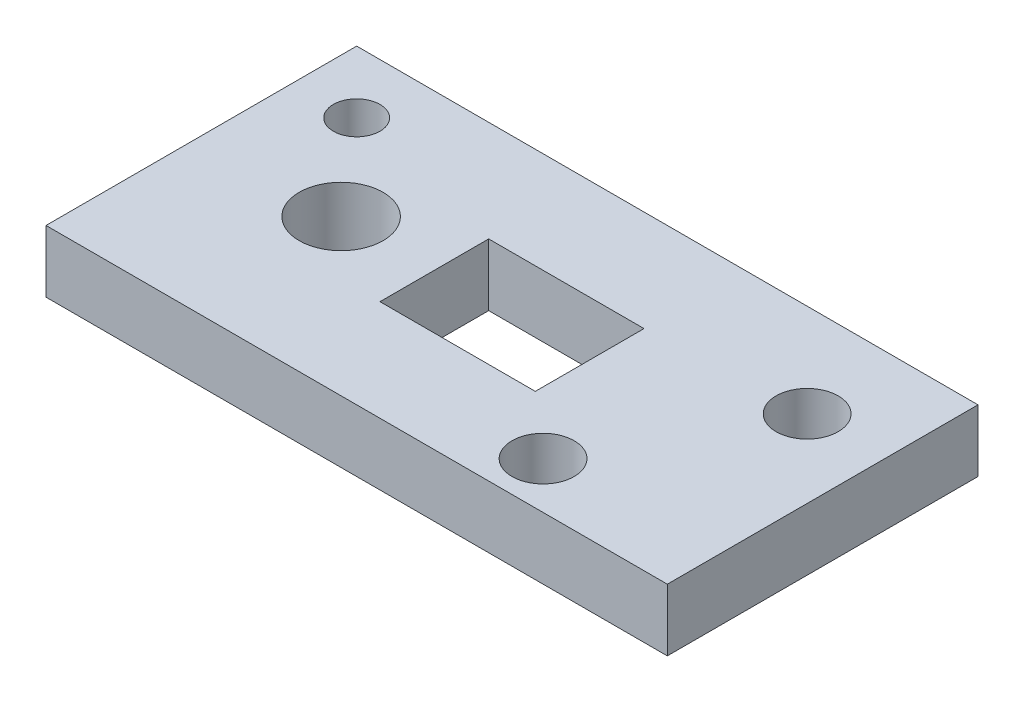
from build123d import *

# Parameters (mm, degrees)
SKETCH1_W           = 200
SKETCH1_H           = 100
BOSS_EXTRUDE1_DEPTH = 10
SKETCH2_R           = 7.5
SKETCH2_R_2         = 13.5
SKETCH2_R_3         = 10
SKETCH2_W           = 50
SKETCH2_H           = 35
CUT_EXTRUDE1_DEPTH  = 114.578166916


with BuildPart() as part:
    # Sketch1 → Boss-Extrude1 (new, symmetric)
    with BuildSketch(Plane(origin=(0, 0, 0), x_dir=(1, 0, 0), z_dir=(0, 1, 0))):
        Rectangle(SKETCH1_W, SKETCH1_H)
    extrude(amount=BOSS_EXTRUDE1_DEPTH, both=True)

    # Sketch2 → Cut-Extrude1 (cut, through all)
    with BuildSketch(Plane(origin=(0, 10, 0), x_dir=(1, 0, 0), z_dir=(0, 1, 0))):
        with Locations(Location((-80, 30, 0), (0, 0, 270))):
            Circle(SKETCH2_R)
        with Locations(Location((-55, 0, 0), (0, 0, 270))):
            Circle(SKETCH2_R_2)
        with Locations(Location((75, 20, 0), (0, 0, 270))):
            Circle(SKETCH2_R_3)
        with Locations(Location((45, -35, 0), (0, 0, 270))):
            Circle(SKETCH2_R_3)
        Rectangle(SKETCH2_W, SKETCH2_H)
    extrude(amount=-CUT_EXTRUDE1_DEPTH, mode=Mode.SUBTRACT)


solid = part.part
